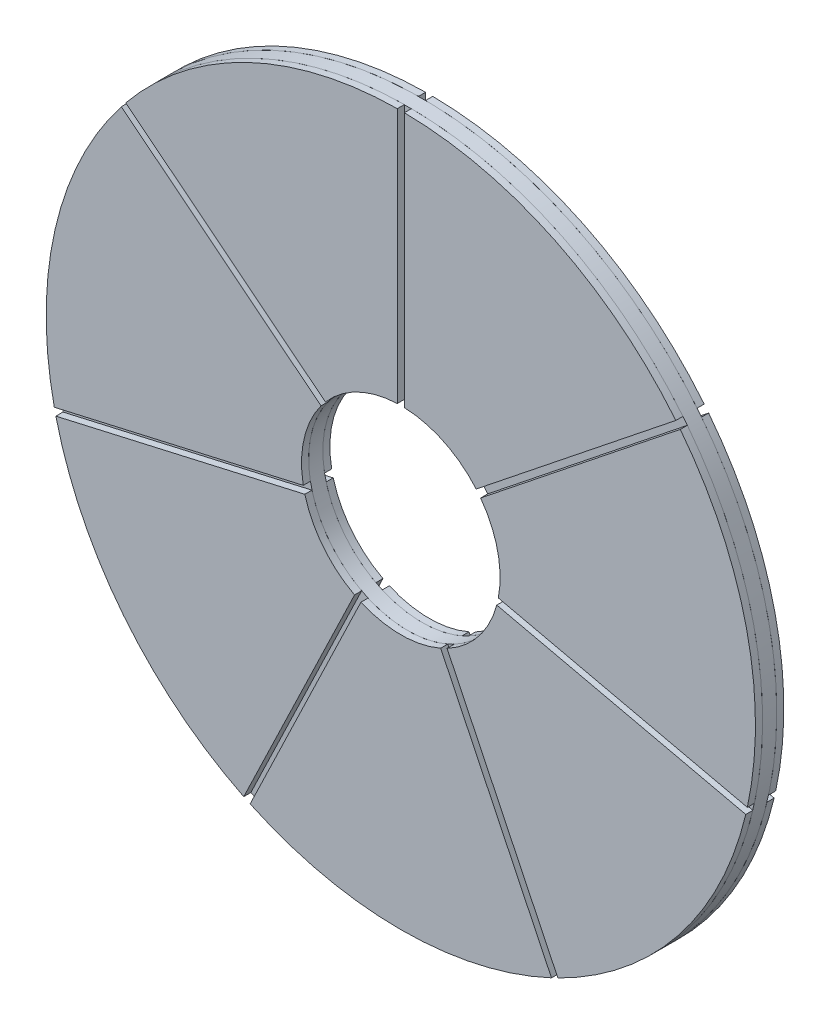
from build123d import *

# Parameters (mm, degrees)
BOSS_EXTRUDE1_DEPTH      = 0.25
BOSS_EXTRUDE1_DEPTH_BACK = 0.25
SKETCH1_R                = 12.5
BOSS_EXTRUDE2_DEPTH      = 0.25
BOSS_EXTRUDE2_2_DEPTH    = 0.25
BOSS_EXTRUDE2_3_DEPTH    = 0.25
BOSS_EXTRUDE2_4_DEPTH    = 0.25
BOSS_EXTRUDE2_5_DEPTH    = 0.25
BOSS_EXTRUDE2_6_DEPTH    = 0.25
BOSS_EXTRUDE2_7_DEPTH    = 0.25
CUT_EXTRUDE2_DEPTH       = 10
CUT_EXTRUDE2_DEPTH_BACK  = 8.35
SKETCH3_R                = 3.5


with BuildPart() as part:
    # Sketch1 → Boss-Extrude1 (new, two sides: drawn at the far end of the back side and taken through both)
    with BuildSketch(Plane.XY.offset(-BOSS_EXTRUDE1_DEPTH_BACK)):
        Circle(SKETCH1_R)
    extrude(amount=BOSS_EXTRUDE1_DEPTH + BOSS_EXTRUDE1_DEPTH_BACK)


with BuildPart() as body_2:
    # Sketch2 → Boss-Extrude2 (new body)
    with BuildSketch(Plane.XY.offset(0.25)):
        with BuildLine():
            Line((0.125, 12.499374984), (0.125, 0.259565175))
            Line((0.125, 0.259565175), (9.694468649, 7.890961768))
            ThreePointArc((9.694468649, 7.890961768), (5.423546739, 11.262110849), (0.125, 12.499374984))
        make_face()
    extrude(amount=BOSS_EXTRUDE2_DEPTH)


with BuildPart() as body_3:
    # Sketch2 → Boss-Extrude2 2 (new body)
    with BuildSketch(Plane.XY.offset(0.25)):
        with BuildLine():
            Line((-9.694468649, 7.890961768), (-0.125, 0.259565175))
            Line((-0.125, 0.259565175), (-0.125, 12.499374984))
            ThreePointArc((-0.125, 12.499374984), (-5.423546739, 11.262110849), (-9.694468649, 7.890961768))
        make_face()
    extrude(amount=BOSS_EXTRUDE2_2_DEPTH)


with BuildPart() as body_4:
    # Sketch2 → Boss-Extrude2 3 (new body)
    with BuildSketch(Plane.XY.offset(0.25)):
        with BuildLine():
            Line((-12.213804674, -2.659506606), (-0.28087245, 0.064107304))
            Line((-0.28087245, 0.064107304), (-9.850341099, 7.695503897))
            ThreePointArc((-9.850341099, 7.695503897), (-12.186598902, 2.781511674), (-12.213804674, -2.659506606))
        make_face()
    extrude(amount=BOSS_EXTRUDE2_3_DEPTH)


with BuildPart() as body_5:
    # Sketch2 → Boss-Extrude2 4 (new body)
    with BuildSketch(Plane.XY.offset(0.25)):
        with BuildLine():
            Line((9.850341099, 7.695503897), (0.28087245, 0.064107304))
            Line((0.28087245, 0.064107304), (12.213804674, -2.659506606))
            ThreePointArc((12.213804674, -2.659506606), (12.186598902, 2.781511674), (9.850341099, 7.695503897))
        make_face()
    extrude(amount=BOSS_EXTRUDE2_4_DEPTH)


with BuildPart() as body_6:
    # Sketch2 → Boss-Extrude2 5 (new body)
    with BuildSketch(Plane.XY.offset(0.25)):
        with BuildLine():
            Line((12.15817444, -2.903238584), (0.225242217, -0.179624674))
            Line((0.225242217, -0.179624674), (5.535896663, -11.207312262))
            ThreePointArc((5.535896663, -11.207312262), (9.772893531, -7.793622523), (12.15817444, -2.903238584))
        make_face()
    extrude(amount=BOSS_EXTRUDE2_5_DEPTH)


with BuildPart() as body_7:
    # Sketch2 → Boss-Extrude2 6 (new body)
    with BuildSketch(Plane.XY.offset(0.25)):
        with BuildLine():
            Line((5.310654446, -11.315783197), (0, -0.288095609))
            Line((0, -0.288095609), (-5.310654446, -11.315783197))
            ThreePointArc((-5.310654446, -11.315783197), (0, -12.5), (5.310654446, -11.315783197))
        make_face()
    extrude(amount=BOSS_EXTRUDE2_6_DEPTH)


with BuildPart() as body_8:
    # Sketch2 → Boss-Extrude2 7 (new body)
    with BuildSketch(Plane.XY.offset(0.25)):
        with BuildLine():
            Line((-5.535896663, -11.207312262), (-0.225242217, -0.179624674))
            Line((-0.225242217, -0.179624674), (-12.15817444, -2.903238584))
            ThreePointArc((-12.15817444, -2.903238584), (-9.772893531, -7.793622523), (-5.535896663, -11.207312262))
        make_face()
    extrude(amount=BOSS_EXTRUDE2_7_DEPTH)


with BuildPart() as body_9:
    # Mirror5: mirrored copy
    add(body_2.part.mirror(Plane.XY))


with BuildPart() as body_10:
    # Mirror5 2: mirrored copy
    add(body_3.part.mirror(Plane.XY))


with BuildPart() as body_11:
    # Mirror5 3: mirrored copy
    add(body_5.part.mirror(Plane.XY))


with BuildPart() as body_12:
    # Mirror5 4: mirrored copy
    add(body_6.part.mirror(Plane.XY))


with BuildPart() as body_13:
    # Mirror5 5: mirrored copy
    add(body_7.part.mirror(Plane.XY))


with BuildPart() as body_14:
    # Mirror5 6: mirrored copy
    add(body_8.part.mirror(Plane.XY))


with BuildPart() as body_15:
    # Mirror5 7: mirrored copy
    add(body_4.part.mirror(Plane.XY))


with BuildPart() as cut_extrude2_tool:
    # Sketch3 → Cut-Extrude2 (new, two sides: drawn at the far end of the back side and taken through both)
    with BuildSketch(Plane.XY.offset(-CUT_EXTRUDE2_DEPTH_BACK)):
        Circle(SKETCH3_R)
    extrude(amount=CUT_EXTRUDE2_DEPTH + CUT_EXTRUDE2_DEPTH_BACK)


with BuildPart() as part_1:
    add(part.part)

    # Cut-Extrude2: cut by cut_extrude2_tool
    add(cut_extrude2_tool.part, mode=Mode.SUBTRACT)


with BuildPart() as body_2_1:
    add(body_2.part)

    # Cut-Extrude2: cut by cut_extrude2_tool
    add(cut_extrude2_tool.part, mode=Mode.SUBTRACT)


with BuildPart() as body_3_1:
    add(body_3.part)

    # Cut-Extrude2: cut by cut_extrude2_tool
    add(cut_extrude2_tool.part, mode=Mode.SUBTRACT)


with BuildPart() as body_4_1:
    add(body_4.part)

    # Cut-Extrude2: cut by cut_extrude2_tool
    add(cut_extrude2_tool.part, mode=Mode.SUBTRACT)


with BuildPart() as body_5_1:
    add(body_5.part)

    # Cut-Extrude2: cut by cut_extrude2_tool
    add(cut_extrude2_tool.part, mode=Mode.SUBTRACT)


with BuildPart() as body_6_1:
    add(body_6.part)

    # Cut-Extrude2: cut by cut_extrude2_tool
    add(cut_extrude2_tool.part, mode=Mode.SUBTRACT)


with BuildPart() as body_7_1:
    add(body_7.part)

    # Cut-Extrude2: cut by cut_extrude2_tool
    add(cut_extrude2_tool.part, mode=Mode.SUBTRACT)


with BuildPart() as body_8_1:
    add(body_8.part)

    # Cut-Extrude2: cut by cut_extrude2_tool
    add(cut_extrude2_tool.part, mode=Mode.SUBTRACT)


with BuildPart() as body_9_1:
    add(body_9.part)

    # Cut-Extrude2: cut by cut_extrude2_tool
    add(cut_extrude2_tool.part, mode=Mode.SUBTRACT)


with BuildPart() as body_10_1:
    add(body_10.part)

    # Cut-Extrude2: cut by cut_extrude2_tool
    add(cut_extrude2_tool.part, mode=Mode.SUBTRACT)


with BuildPart() as body_11_1:
    add(body_11.part)

    # Cut-Extrude2: cut by cut_extrude2_tool
    add(cut_extrude2_tool.part, mode=Mode.SUBTRACT)


with BuildPart() as body_12_1:
    add(body_12.part)

    # Cut-Extrude2: cut by cut_extrude2_tool
    add(cut_extrude2_tool.part, mode=Mode.SUBTRACT)


with BuildPart() as body_13_1:
    add(body_13.part)

    # Cut-Extrude2: cut by cut_extrude2_tool
    add(cut_extrude2_tool.part, mode=Mode.SUBTRACT)


with BuildPart() as body_14_1:
    add(body_14.part)

    # Cut-Extrude2: cut by cut_extrude2_tool
    add(cut_extrude2_tool.part, mode=Mode.SUBTRACT)


with BuildPart() as body_15_1:
    add(body_15.part)

    # Cut-Extrude2: cut by cut_extrude2_tool
    add(cut_extrude2_tool.part, mode=Mode.SUBTRACT)


solid = Compound([part_1.part, body_2_1.part, body_3_1.part, body_4_1.part, body_5_1.part, body_6_1.part, body_7_1.part, body_8_1.part, body_9_1.part, body_10_1.part, body_11_1.part, body_12_1.part, body_13_1.part, body_14_1.part, body_15_1.part])
